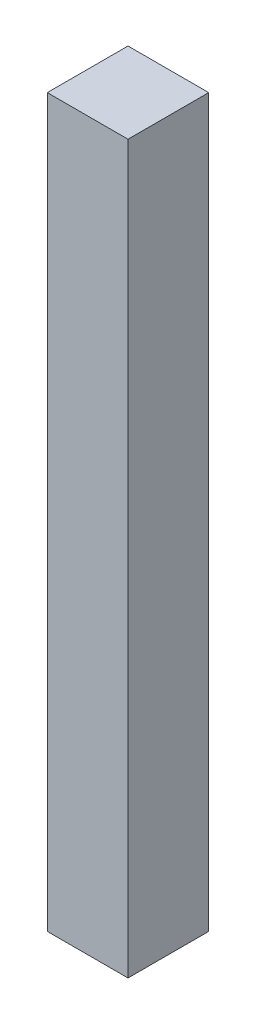
from build123d import *

# Parameters (mm, degrees)
SKETCH_1_W      = 30
SKETCH_1_H      = 30
EXTRUDE_1_DEPTH = 270


with BuildPart() as part:
    # 草图1 → 凸台-拉伸1 (new body)
    with BuildSketch(Plane(origin=(0, 0, 0), x_dir=(1, 0, 0), z_dir=(0, 1, 0))):
        with Locations((15, -15)):
            Rectangle(SKETCH_1_W, SKETCH_1_H)
    extrude(amount=EXTRUDE_1_DEPTH)


solid = part.part
